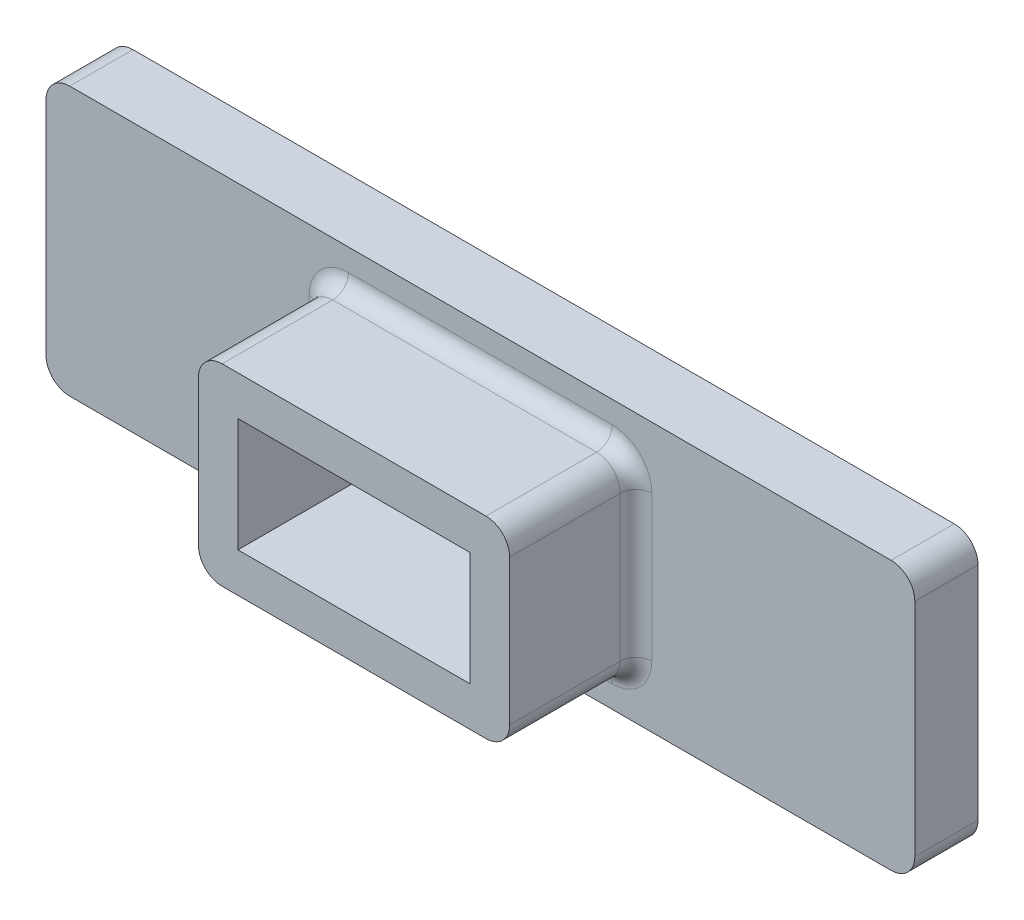
from build123d import *

# Parameters (mm, degrees)
SKETCH1_W           = 69.85
SKETCH1_H           = 21.59
BOSS_EXTRUDE1_DEPTH = 5.08
SKETCH2_W           = 25.019
SKETCH2_H           = 15.494
SKETCH2_W_2         = 18.669
SKETCH2_H_2         = 9.144
BOSS_EXTRUDE2_DEPTH = 10.16
FILLET2_R           = 1.905
FILLET3_R           = 1.27


with BuildPart() as part:
    # Sketch1 → Boss-Extrude1 (new body)
    with BuildSketch(Plane.XY):
        Rectangle(SKETCH1_W, SKETCH1_H)
    extrude(amount=BOSS_EXTRUDE1_DEPTH)

    # Sketch2 → Boss-Extrude2 (add)
    with BuildSketch(Plane.XY.offset(5.08)):
        Rectangle(SKETCH2_W, SKETCH2_H)
        Rectangle(SKETCH2_W_2, SKETCH2_H_2, mode=Mode.SUBTRACT)
    extrude(amount=BOSS_EXTRUDE2_DEPTH)

    # Fillet2
    fillet2_edges = [part.edges().sort_by_distance(p)[0] for p in [
        (12.5095, -7.747, 10.16),
        (12.5095, 7.747, 10.16),
        (-12.5095, 7.747, 10.16),
        (-12.5095, -7.747, 10.16),
        (34.925, -10.795, 2.54),
        (-34.925, -10.795, 2.54),
        (-34.925, 10.795, 2.54),
        (34.925, 10.795, 2.54),
    ]]
    fillet(fillet2_edges, radius=FILLET2_R)

    # Fillet3
    fillet3_edges = [part.edges().sort_by_distance(p)[0] for p in [
        (-12.5095, 0, 5.08),
        (0, 7.747, 5.08),
        (12.5095, 0, 5.08),
        (0, -7.747, 5.08),
        (-11.951538418, 7.189038418, 5.08),
        (11.951538418, 7.189038418, 5.08),
        (11.951538418, -7.189038418, 5.08),
        (-11.951538418, -7.189038418, 5.08),
    ]]
    fillet(fillet3_edges, radius=FILLET3_R)


solid = part.part
